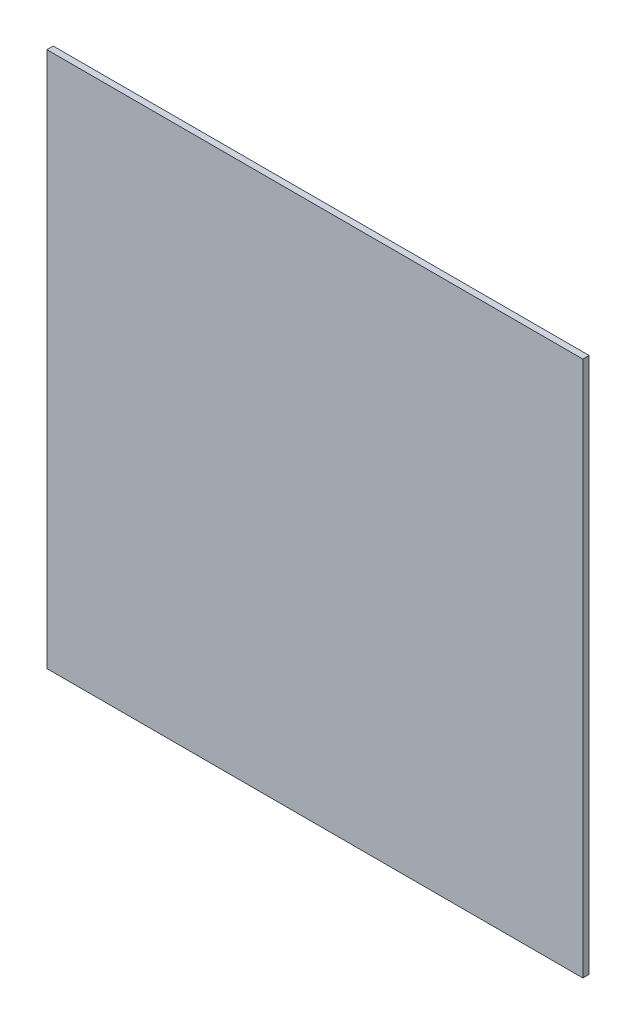
from build123d import *

# Parameters (mm, degrees)
SKETCH2_W           = 340
SKETCH2_H           = 340
BOSS_EXTRUDE2_DEPTH = 4


with BuildPart() as part:
    # Sketch2 → Boss-Extrude2 (new body)
    with BuildSketch(Plane.XY):
        Rectangle(SKETCH2_W, SKETCH2_H)
    extrude(amount=BOSS_EXTRUDE2_DEPTH)


solid = part.part
